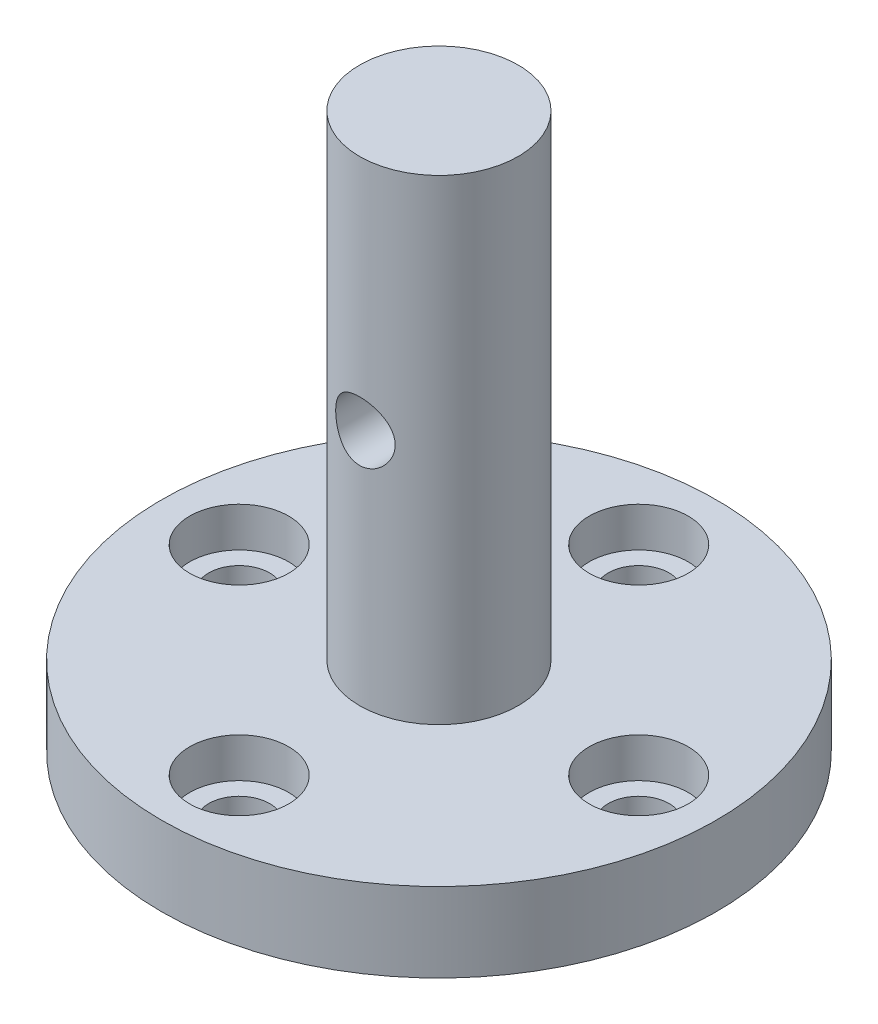
from build123d import *

# Parameters (mm, degrees)
SKETCH1_R                       = 11.1125
BOSS_EXTRUDE1_DEPTH             = 3.175
SKETCH2_R                       = 3.175
BOSS_EXTRUDE2_DEPTH             = 19.05
F_2_CLEARANCE_HOLE1_D           = 2.4384
SKETCH5_R                       = 1.984375
CUT_EXTRUDE1_DEPTH              = 1.5875
F_3_32_0_09375_DIAMETER_HOLE1_D = 2.38125


with BuildPart() as part:
    # Sketch1 → Boss-Extrude1 (new body)
    with BuildSketch(Plane(origin=(0, 0, 0), x_dir=(1, 0, 0), z_dir=(0, 1, 0))):
        with Locations(Location((0, 0, 0), (0, 0, 270))):
            Circle(SKETCH1_R)
    extrude(amount=BOSS_EXTRUDE1_DEPTH)

    # Sketch2 → Boss-Extrude2 (add)
    with BuildSketch(Plane(origin=(0, 3.175, 0), x_dir=(1, 0, 0), z_dir=(0, 1, 0))):
        with Locations(Location((0, 0, 0), (0, 0, 90))):
            Circle(SKETCH2_R)
    extrude(amount=BOSS_EXTRUDE2_DEPTH)

    # #2 Clearance Hole1 (through all)
    with Locations(Plane(origin=(0, 3.175, 0), x_dir=(1, 0, 0), z_dir=(0, 1, 0))):
        with Locations((0, -8), (0, 8), (-8, 0), (8, 0)):
            Hole(F_2_CLEARANCE_HOLE1_D / 2)

    # Sketch5 → Cut-Extrude1 (cut)
    with BuildSketch(Plane(origin=(0, 3.175, 0), x_dir=(1, 0, 0), z_dir=(0, 1, 0))):
        with Locations(Location((0, -8, 0), (0, 0, 270))):
            Circle(SKETCH5_R)
        with Locations(Location((8, 0, 0), (0, 0, 270))):
            Circle(SKETCH5_R)
        with Locations(Location((0, 8, 0), (0, 0, 270))):
            Circle(SKETCH5_R)
        with Locations(Location((-8, 0, 0), (0, 0, 270))):
            Circle(SKETCH5_R)
    extrude(amount=-CUT_EXTRUDE1_DEPTH, mode=Mode.SUBTRACT)

    # 3/32 (0.09375) Diameter Hole1 (through all)
    with Locations(Plane.XY.offset(3.175)):
        with Locations((0, 12.7)):
            Hole(F_3_32_0_09375_DIAMETER_HOLE1_D / 2)


solid = part.part
